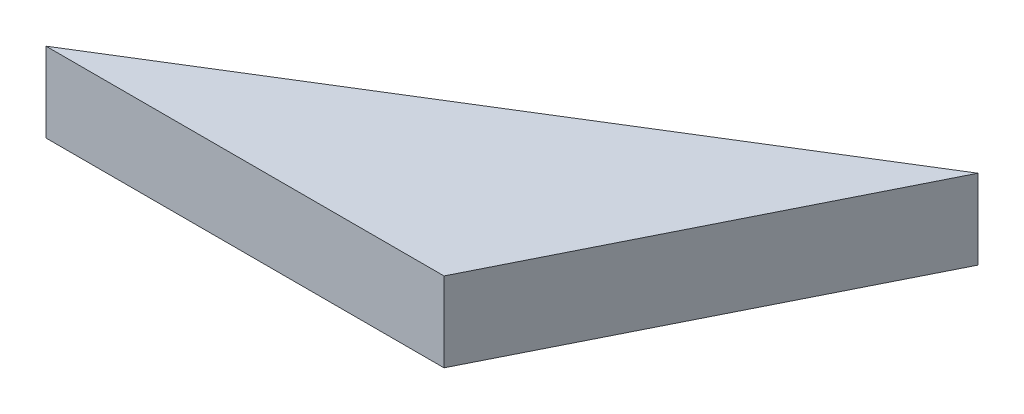
from build123d import *

# Parameters (mm, degrees)
BOSS_EXTRUDE1_DEPTH = 6


with BuildPart() as part:
    # Sketch1 → Boss-Extrude1 (new body)
    with BuildSketch(Plane(origin=(0, 0, 0), x_dir=(1, 0, 0), z_dir=(0, 1, 0))):
        Polygon((0, 0), (-30, 0), (13.418725453, 26.831656811), align=None)
    extrude(amount=BOSS_EXTRUDE1_DEPTH)


solid = part.part
